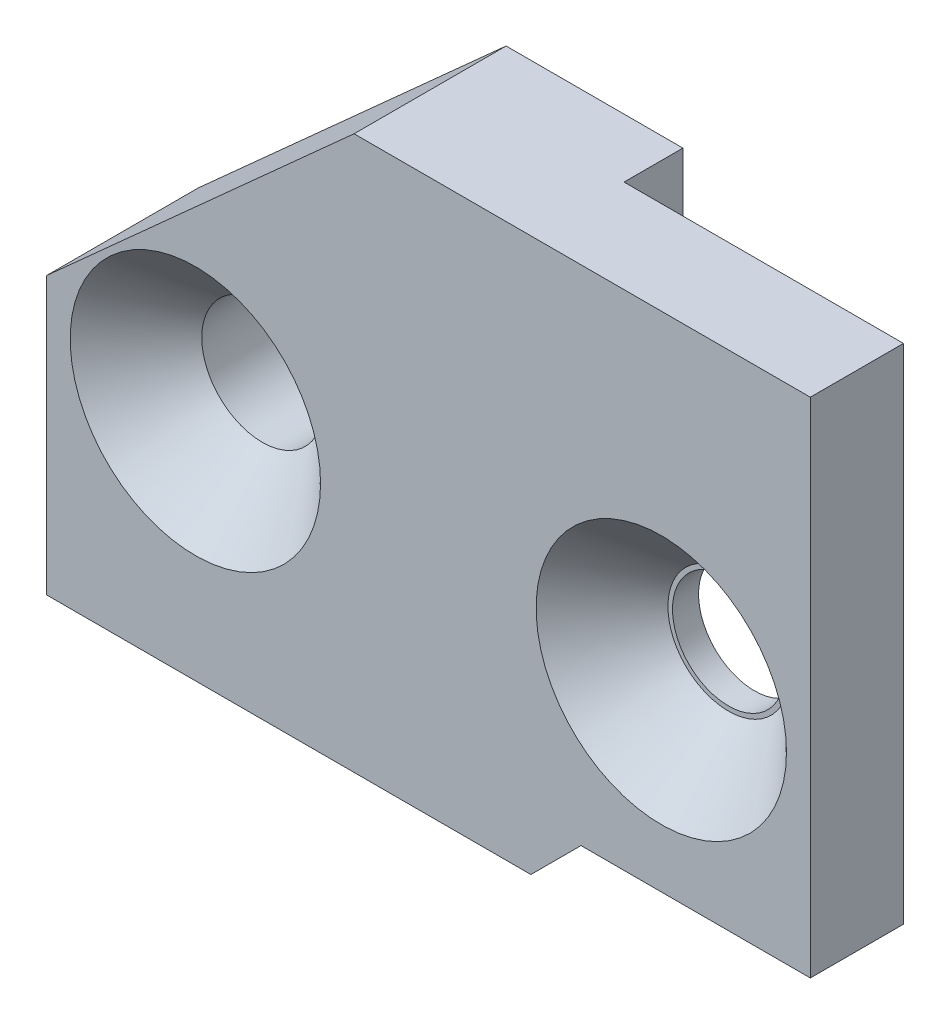
from build123d import *

# Parameters (mm, degrees)
CROQUIS1_R                      = 1.625
CROQUIS1_R_2                    = 1.5
SALIENTE_EXTRUIR1_DEPTH         = 2.5
CROQUIS3_R                      = 3.35997123
CORTAR_EXTRUIR1_DEPTH           = 1.8
CORTAR_EXTRUIR1_DRAFT           = -44
CORTAR_EXTRUIR1_PROFILE_2_DEPTH = 1.8
CORTAR_EXTRUIR1_PROFILE_2_DRAFT = -44
SALIENTE_EXTRUIR2_START         = 1.58
CROQUIS4_R                      = 1.625
SALIENTE_EXTRUIR2_DEPTH         = 1.58


with BuildPart() as part:
    # Croquis1 → Saliente-Extruir1 (new body)
    with BuildSketch(Plane.XY):
        Polygon((-181.732371, -74.071146), (-173.47767153, -66.648646), (-161.232371, -66.648646), (-161.232371, -80.148646), (-167.387371, -80.148646), (-168.732371, -81.493646), (-181.732371, -81.493646), align=None)
        with Locations((-177.73707047, -75.223646)):
            Circle(CROQUIS1_R, mode=Mode.SUBTRACT)
        with Locations((-165.232371, -75.223646)):
            Circle(CROQUIS1_R_2, mode=Mode.SUBTRACT)
    extrude(amount=SALIENTE_EXTRUIR1_DEPTH)


with BuildPart() as cortar_extruir1_tool:
    # Croquis3 → Cortar-Extruir1 (with draft: the straight prism first)
    with BuildSketch(Plane.XY.offset(2.5)):
        with Locations((-177.73707047, -75.223646)):
            Circle(CROQUIS3_R)
    extrude(amount=-CORTAR_EXTRUIR1_DEPTH)
    # Cortar-Extruir1: the draft: its side faces are tilted about the plane it starts from
    cortar_extruir1_sides = [cortar_extruir1_tool.faces().sort_by_distance(p)[0] for p in [
        (-181.0970417, -75.223646, 1.6),
    ]]
    draft(cortar_extruir1_sides, Plane.XY.offset(2.5), CORTAR_EXTRUIR1_DRAFT)


with BuildPart() as part_1:
    add(part.part)

    # Cortar-Extruir1: cut by cortar_extruir1_tool
    add(cortar_extruir1_tool.part, mode=Mode.SUBTRACT)


with BuildPart() as cortar_extruir1_profile_2_tool:
    # Croquis3 → Cortar-Extruir1 profile 2 (with draft: the straight prism first)
    with BuildSketch(Plane.XY.offset(2.5)):
        with Locations((-165.232371, -75.223646)):
            Circle(CROQUIS3_R)
    extrude(amount=-CORTAR_EXTRUIR1_PROFILE_2_DEPTH)
    # Cortar-Extruir1 profile 2: the draft: its side faces are tilted about the plane it starts from
    cortar_extruir1_profile_2_sides = [cortar_extruir1_profile_2_tool.faces().sort_by_distance(p)[0] for p in [
        (-168.59234223, -75.223646, 1.6),
    ]]
    draft(cortar_extruir1_profile_2_sides, Plane.XY.offset(2.5), CORTAR_EXTRUIR1_PROFILE_2_DRAFT)


with BuildPart() as part_2:
    add(part_1.part)

    # Cortar-Extruir1 profile 2: cut by cortar_extruir1_profile_2_tool
    add(cortar_extruir1_profile_2_tool.part, mode=Mode.SUBTRACT)

    # Croquis4 → Saliente-Extruir2 (add)
    with BuildSketch(Plane(origin=(0, 0, 0), x_dir=(-1, 0, 0), z_dir=(0, 0, -1)).offset(SALIENTE_EXTRUIR2_START)):
        Polygon((173.47767153, -66.648646), (181.732371, -74.071146), (181.732371, -80.148646), (168.732371, -80.148646), (168.732371, -66.648646), align=None)
        with Locations((177.73707047, -75.223646)):
            Circle(CROQUIS4_R, mode=Mode.SUBTRACT)
    extrude(amount=-SALIENTE_EXTRUIR2_DEPTH)


solid = part_2.part
